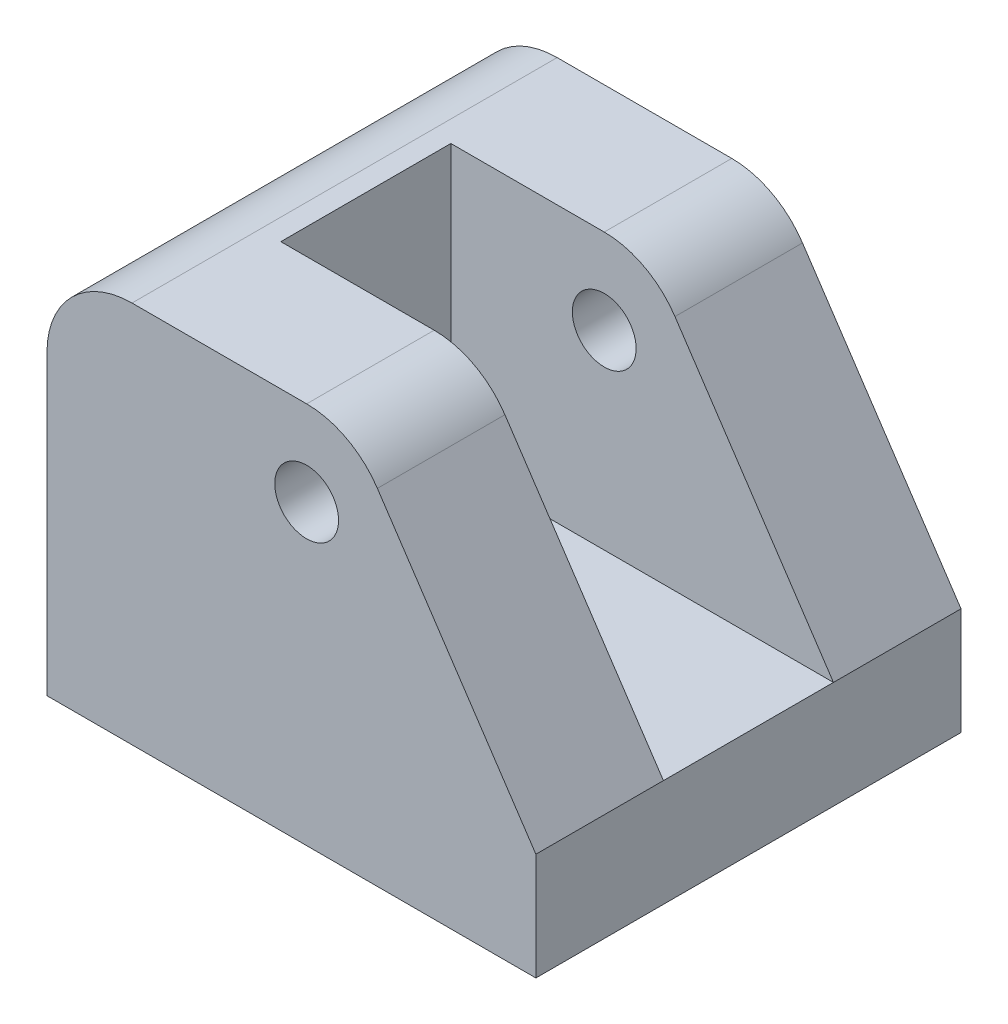
from build123d import *

# Parameters (mm, degrees)
SKETCH2_W           = 230
SKETCH2_H           = 200
BOSS_EXTRUDE1_DEPTH = 180
CUT_EXTRUDE1_DEPTH  = 200
FILLET2_R           = 40
SKETCH4_R           = 30
CUT_EXTRUDE2_DEPTH  = 48
SKETCH5_W           = 80
SKETCH5_H           = 129.575317766
CUT_EXTRUDE3_DEPTH  = 180
SKETCH6_R           = 15
CUT_EXTRUDE5_DEPTH  = 200


with BuildPart() as part:
    # Sketch2 → Boss-Extrude1 (new body)
    with BuildSketch(Plane(origin=(0, 0, 0), x_dir=(1, 0, 0), z_dir=(0, 1, 0))):
        with Locations((71.865714122, -63.208991457)):
            Rectangle(SKETCH2_W, SKETCH2_H)
    extrude(amount=BOSS_EXTRUDE1_DEPTH)

    # Sketch3 → Cut-Extrude1 (cut)
    with BuildSketch(Plane.XY.offset(163.208991457)):
        Polygon((100.422581047, 180), (186.865714122, 180), (186.865714122, 50.424682234), align=None)
    extrude(amount=-CUT_EXTRUDE1_DEPTH, mode=Mode.SUBTRACT)

    # Fillet2
    fillet2_edges = [part.edges().sort_by_distance(p)[0] for p in [
        (100.422581047, 180, 63.208991457),
        (-43.134285878, 180, 63.208991457),
    ]]
    fillet(fillet2_edges, radius=FILLET2_R)

    # Sketch4 → Cut-Extrude2 (cut)
    with BuildSketch(Plane.XZ):
        with Locations(Location((71.865714122, 63.208991457, 0), (0, 0, 270))):
            Circle(SKETCH4_R)
    extrude(amount=-CUT_EXTRUDE2_DEPTH, mode=Mode.SUBTRACT)

    # Sketch5 → Cut-Extrude3 (cut)
    with BuildSketch(Plane(origin=(186.865714122, 0, 0), x_dir=(0, 0, -1), z_dir=(1, 0, 0))):
        with Locations((-63.208991457, 115.212341117)):
            Rectangle(SKETCH5_W, SKETCH5_H)
    extrude(amount=-CUT_EXTRUDE3_DEPTH, mode=Mode.SUBTRACT)

    # Sketch6 → Cut-Extrude5 (cut)
    with BuildSketch(Plane.XY.offset(163.208991457)):
        with Locations((79.023419486, 140)):
            Circle(SKETCH6_R)
    extrude(amount=-CUT_EXTRUDE5_DEPTH, mode=Mode.SUBTRACT)


solid = part.part
